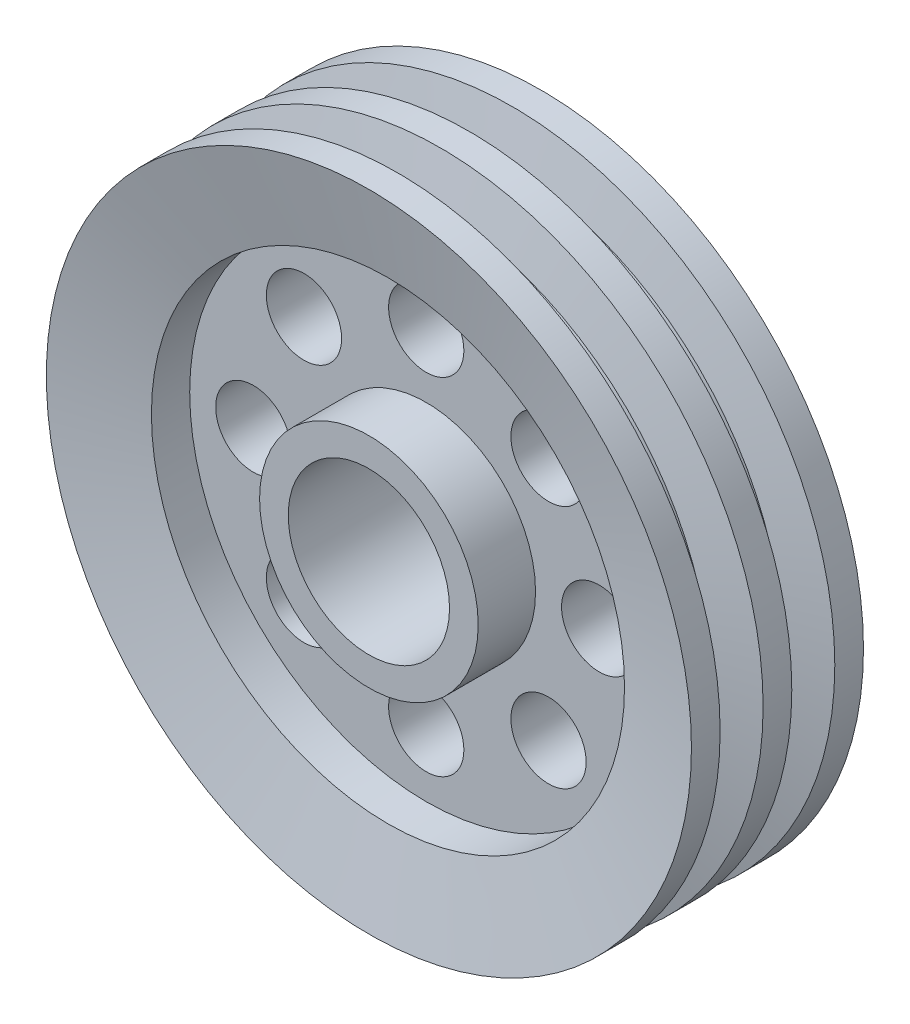
from build123d import *

# Parameters (mm, degrees)
SKETCH1_R             = 50.833333333
SKETCH1_R_2           = 37.5
BOSS_EXTRUDE1_DEPTH   = 40
SKETCH1_R_3           = 150
SKETCH1_R_4           = 110
BOSS_EXTRUDE1_2_DEPTH = 40
SKETCH1_3_R           = 17.5
BOSS_EXTRUDE2_DEPTH   = 13.333333333


with BuildPart() as part:
    # Sketch1 → Boss-Extrude1 (new, symmetric)
    with BuildSketch(Plane.XY):
        Circle(SKETCH1_R)
        Circle(SKETCH1_R_2, mode=Mode.SUBTRACT)
    extrude(amount=BOSS_EXTRUDE1_DEPTH, both=True)



with BuildPart() as body_2:
    # Sketch1 → Boss-Extrude1 2 (new, symmetric)
    with BuildSketch(Plane.XY):
        Circle(SKETCH1_R_3)
        Circle(SKETCH1_R_4, mode=Mode.SUBTRACT)
    extrude(amount=BOSS_EXTRUDE1_2_DEPTH, both=True)


with BuildPart() as part_1:
    add(part.part)

    add(body_2.part)  # Boss-Extrude2 merges body 2
    # Sketch1<3> → Boss-Extrude2 (add, symmetric)
    with BuildSketch(Plane.XY):
        with BuildLine():
            ThreePointArc((110, 0), (77.781745931, 77.781745931), (0, 110))
            ThreePointArc((0, 110), (-77.781745931, -77.781745931), (110, 0))
        make_face()
        with Locations((-56.86317032, -56.86317032)):
            Circle(SKETCH1_3_R, mode=Mode.SUBTRACT)
        with Locations((0, -80.416666667)):
            Circle(SKETCH1_3_R, mode=Mode.SUBTRACT)
        with Locations((56.86317032, -56.86317032)):
            Circle(SKETCH1_3_R, mode=Mode.SUBTRACT)
        with Locations((-80.416666667, 0)):
            Circle(SKETCH1_3_R, mode=Mode.SUBTRACT)
        with Locations((-56.86317032, 56.86317032)):
            Circle(SKETCH1_3_R, mode=Mode.SUBTRACT)
        with BuildLine():
            ThreePointArc((50.833333333, 0), (-35.94459471, -35.94459471), (0, 50.833333333))
            ThreePointArc((0, 50.833333333), (35.94459471, 35.94459471), (50.833333333, 0))
        make_face(mode=Mode.SUBTRACT)
        with Locations((56.86317032, 56.86317032)):
            Circle(SKETCH1_3_R, mode=Mode.SUBTRACT)
        with Locations((80.416666667, 0)):
            Circle(SKETCH1_3_R, mode=Mode.SUBTRACT)
        with BuildLine():
            ThreePointArc((17.5, 80.416666667), (12.374368671, 68.042297996), (0, 62.916666667))
            ThreePointArc((0, 62.916666667), (-17.5, 80.416666667), (0, 97.916666667))
            ThreePointArc((0, 97.916666667), (12.374368671, 92.791035337), (17.5, 80.416666667))
        make_face(mode=Mode.SUBTRACT)
    extrude(amount=BOSS_EXTRUDE2_DEPTH, both=True)

    # Sketch2 → Cut-Revolve2 (revolve, cut)
    with BuildSketch(Plane(origin=(0, 0, 0), x_dir=(0, 0, -1), z_dir=(1, 0, 0))):
        Polygon((-40, 150), (-31.132213494, 110), (-40, 110), align=None)
    revolve(axis=Axis((0, 0, 46.027380227), (0, 0, -1)), mode=Mode.SUBTRACT)

    # Sketch2<5> → Cut-Revolve3 (revolve, cut)
    with BuildSketch(Plane(origin=(0, 0, 0), x_dir=(0, 0, -1), z_dir=(1, 0, 0))):
        Polygon((31.132213494, 110), (40, 110), (40, 150), align=None)
    revolve(axis=Axis((0, 0, 46.027380227), (0, 0, -1)), mode=Mode.SUBTRACT)

    # Sketch2<7> → Cut-Revolve5 (revolve, cut)
    with BuildSketch(Plane(origin=(0, 0, 0), x_dir=(0, 0, -1), z_dir=(1, 0, 0))):
        Polygon((-6.666666667, 150), (-26.666666667, 150), (-22.232773414, 130), (-11.10055992, 130), align=None)
    cut_revolve5 = revolve(axis=Axis((0, 0, 46.027380227), (0, 0, -1)), mode=Mode.SUBTRACT)

    # Mirror1: Cut-Revolve5 across plane
    add(cut_revolve5.mirror(Plane.XY), mode=Mode.SUBTRACT)


solid = part_1.part
